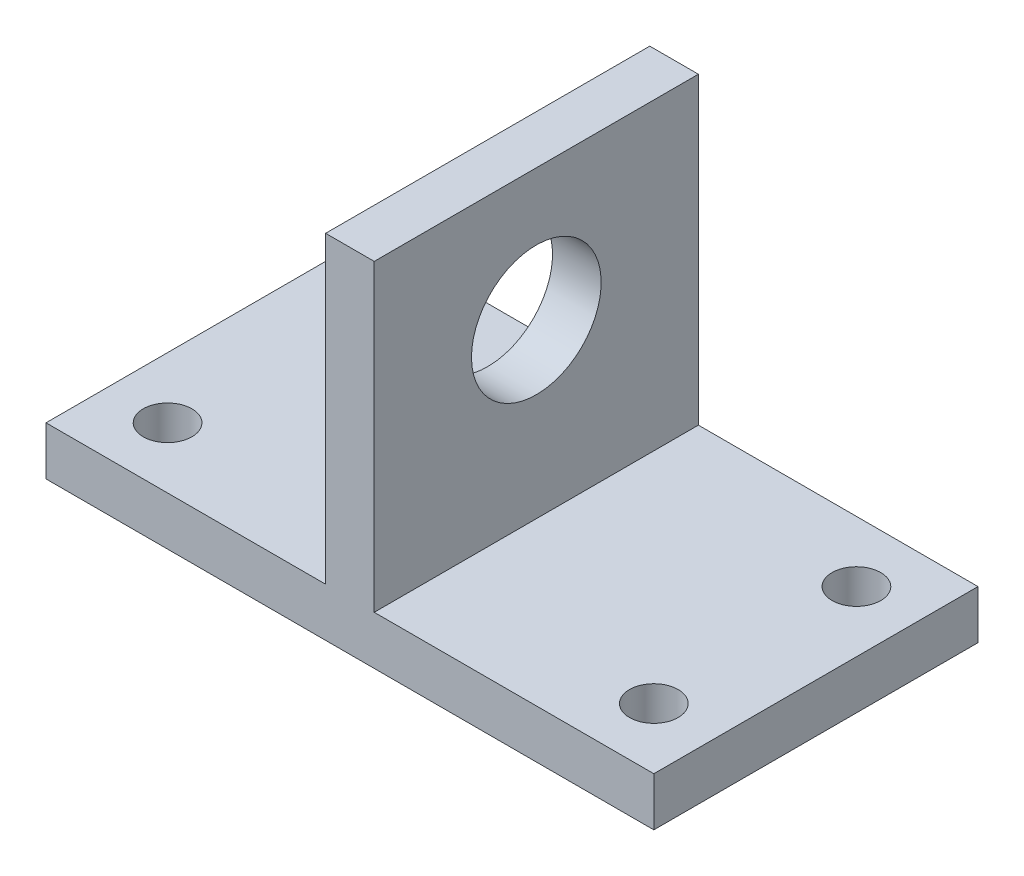
from build123d import *

# Parameters (mm, degrees)
ESBO_O1_W                = 150
ESBO_O1_H                = 80
ESBO_O1_R                = 6
RESSALTO_EXTRUS_O1_DEPTH = 12
ESBO_O2_W                = 12
ESBO_O2_H                = 80
RESSALTO_EXTRUS_O2_DEPTH = 75
ESBO_O3_R                = 16
CORTE_EXTRUS_O1_DEPTH    = 126.419296761


with BuildPart() as part:
    # Esboço1 → Ressalto-extrusão1 (new body)
    with BuildSketch(Plane(origin=(0, 0, 0), x_dir=(1, 0, 0), z_dir=(0, 1, 0))):
        Rectangle(ESBO_O1_W, ESBO_O1_H)
        with Locations(Location((-60, 25, 0), (0, 0, 270))):
            Circle(ESBO_O1_R, mode=Mode.SUBTRACT)
        with Locations(Location((-60, -25, 0), (0, 0, 270))):
            Circle(ESBO_O1_R, mode=Mode.SUBTRACT)
        with Locations(Location((60, 25, 0), (0, 0, 270))):
            Circle(ESBO_O1_R, mode=Mode.SUBTRACT)
        with Locations(Location((60, -25, 0), (0, 0, 270))):
            Circle(ESBO_O1_R, mode=Mode.SUBTRACT)
    extrude(amount=RESSALTO_EXTRUS_O1_DEPTH)

    # Esboço2 → Ressalto-extrusão2 (add)
    with BuildSketch(Plane(origin=(0, 12, 0), x_dir=(1, 0, 0), z_dir=(0, 1, 0))):
        Rectangle(ESBO_O2_W, ESBO_O2_H)
    extrude(amount=RESSALTO_EXTRUS_O2_DEPTH)

    # Esboço3 → Corte-extrusão1 (cut, through all)
    with BuildSketch(Plane.ZY.offset(6)):
        with Locations((0, 54.5)):
            Circle(ESBO_O3_R)
    extrude(amount=-CORTE_EXTRUS_O1_DEPTH, mode=Mode.SUBTRACT)


solid = part.part
